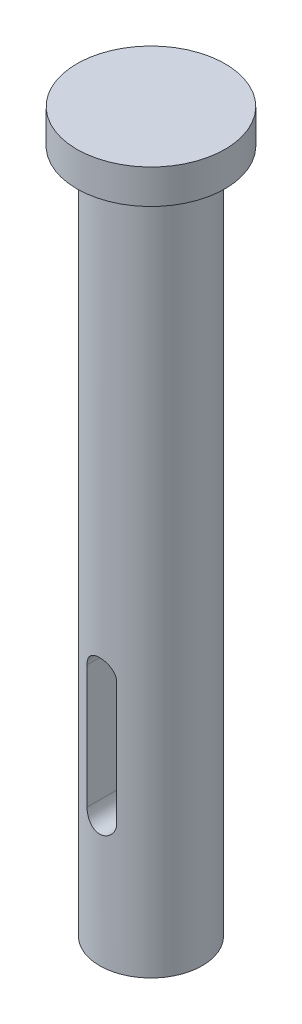
from build123d import *

# Parameters (mm, degrees)
SKETCH1_R           = 11.43
BOSS_EXTRUDE1_DEPTH = 160.02
CUT_EXTRUDE1_DEPTH  = 73.66
BOSS_EXTRUDE2_START = -7.62
SKETCH3_R           = 16.51
SKETCH3_R_2         = 11.43
BOSS_EXTRUDE2_DEPTH = 7.62


with BuildPart() as part:
    # Sketch1 → Boss-Extrude1 (new body)
    with BuildSketch(Plane(origin=(0, 0, 0), x_dir=(1, 0, 0), z_dir=(0, 1, 0))):
        with Locations(Location((0, 0, 0), (0, 0, 270))):
            Circle(SKETCH1_R)
    extrude(amount=BOSS_EXTRUDE1_DEPTH)

    # Sketch2 → Cut-Extrude1 (cut)
    with BuildSketch(Plane.XY.offset(11.43)):
        with BuildLine():
            Line((3.301999683, 28.702000653), (3.301999683, 56.13399967))
            ThreePointArc((3.301999683, 56.13399967), (0, 59.436), (-3.302000317, 56.134000304))
            Line((-3.302000317, 56.134000304), (-3.302000317, 28.702000019))
            ThreePointArc((-3.302000317, 28.702000019), (0, 25.4), (3.301999683, 28.702000653))
        make_face()
    extrude(amount=-CUT_EXTRUDE1_DEPTH, mode=Mode.SUBTRACT)

    # Sketch3 → Boss-Extrude2 (add)
    with BuildSketch(Plane(origin=(0, 160.02, 0), x_dir=(1, 0, 0), z_dir=(0, 1, 0)).offset(BOSS_EXTRUDE2_START)):
        with Locations(Location((0, 0, 0), (0, 0, 270))):
            Circle(SKETCH3_R)
        with Locations(Location((0, 0, 0), (0, 0, 270))):
            Circle(SKETCH3_R_2, mode=Mode.SUBTRACT)
    extrude(amount=BOSS_EXTRUDE2_DEPTH)


solid = part.part
